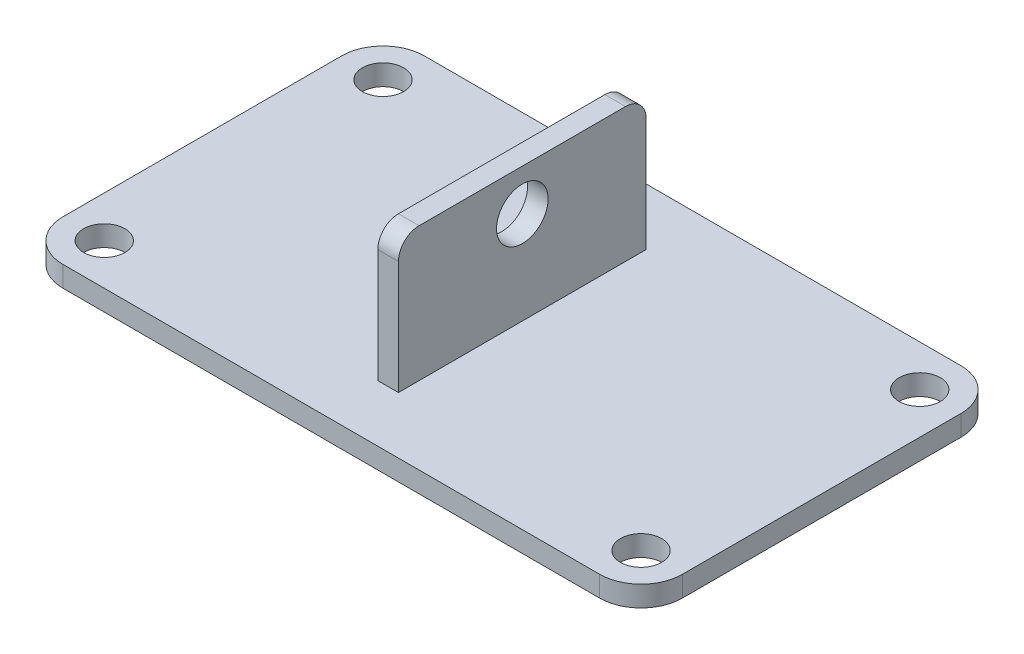
from build123d import *

# Parameters (mm, degrees)
SKETCH4_R           = 10
BOSS_EXTRUDE2_DEPTH = 10
SKETCH5_R           = 12.5
BOSS_EXTRUDE3_DEPTH = 5


with BuildPart() as part:
    # Sketch4 → Boss-Extrude2 (new body)
    with BuildSketch(Plane(origin=(0, 0, 0), x_dir=(1, 0, 0), z_dir=(0, 1, 0))):
        with BuildLine():
            Line((-130, -87.5), (130, -87.5))
            ThreePointArc((130, -87.5), (144.142135624, -81.642135624), (150, -67.5))
            Line((150, -67.5), (150, 67.5))
            ThreePointArc((150, 67.5), (144.142135624, 81.642135624), (130, 87.5))
            Line((130, 87.5), (-130, 87.5))
            ThreePointArc((-130, 87.5), (-144.142135624, 81.642135624), (-150, 67.5))
            Line((-150, 67.5), (-150, -67.5))
            ThreePointArc((-150, -67.5), (-144.142135624, -81.642135624), (-130, -87.5))
        make_face()
        with Locations(Location((-130, 67.5, 0), (0, 0, 270))):
            Circle(SKETCH4_R, mode=Mode.SUBTRACT)
        with Locations(Location((-130, -67.5, 0), (0, 0, 90))):
            Circle(SKETCH4_R, mode=Mode.SUBTRACT)
        with Locations(Location((130, 67.5, 0), (0, 0, 90))):
            Circle(SKETCH4_R, mode=Mode.SUBTRACT)
        with Locations(Location((130, -67.5, 0), (0, 0, 270))):
            Circle(SKETCH4_R, mode=Mode.SUBTRACT)
    extrude(amount=BOSS_EXTRUDE2_DEPTH)


with BuildPart() as body_2:
    # Sketch5 → Boss-Extrude3 (new, symmetric)
    with BuildSketch(Plane(origin=(0, 0, 0), x_dir=(0, 0, -1), z_dir=(1, 0, 0))):
        with BuildLine():
            Line((-60, 10), (-60, 65))
            ThreePointArc((-60, 65), (-57.071067812, 72.071067812), (-50, 75))
            Line((-50, 75), (50, 75))
            ThreePointArc((50, 75), (57.071067812, 72.071067812), (60, 65))
            Line((60, 65), (60, 10))
            Line((60, 10), (-60, 10))
        make_face()
        with Locations((0, 55)):
            Circle(SKETCH5_R, mode=Mode.SUBTRACT)
    extrude(amount=BOSS_EXTRUDE3_DEPTH, both=True)


solid = Compound([part.part, body_2.part])
